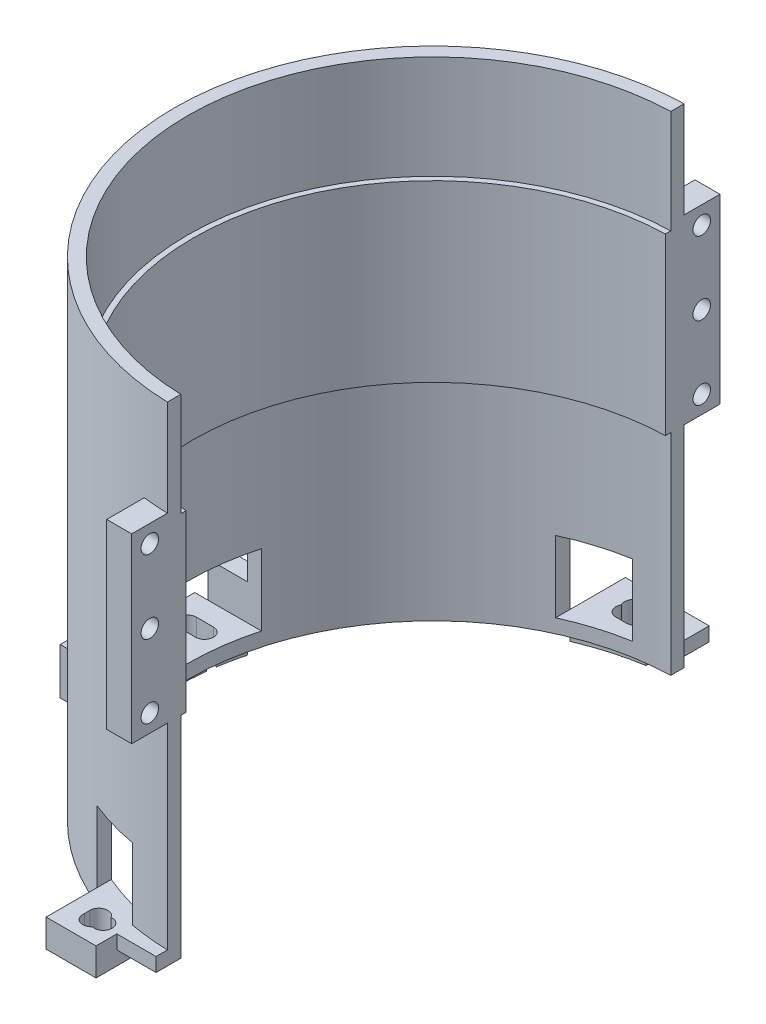
from build123d import *
from build123d.topology import SkipClean

# Parameters (mm, degrees)
BOSS_EXTRUDE1_DEPTH  = 10
BOSS_EXTRUDE2_START  = 73
BOSS_EXTRUDE2_DEPTH  = 73
SKETCH4_R            = 2.5
BOSS_EXTRUDE3_DEPTH  = 3.9
SKETCH6_R            = 2.45
CUT_EXTRUDE1_DEPTH   = 13.9
SKETCH7_W            = 14
SKETCH7_H            = 20
CUT_EXTRUDE2_DEPTH   = 23.9
BOSS_EXTRUDE4_START  = -3.9
BOSS_EXTRUDE4_DEPTH  = 3.9
SKETCH12_W           = 5
SKETCH12_H           = 10
BOSS_EXTRUDE5_DEPTH  = 0.17
SKETCH13_R           = 68.75
CUT_EXTRUDE3_DEPTH   = 73
BOSS_EXTRUDE6_DEPTH  = 27
BOSS_EXTRUDE7_DEPTH  = 27
BOSS_EXTRUDE8_START  = 73
BOSS_EXTRUDE8_DEPTH  = 73
BOSS_EXTRUDE9_START  = -37
BOSS_EXTRUDE9_DEPTH  = 37
BOSS_EXTRUDE10_START = 14
BOSS_EXTRUDE10_DEPTH = 14
CUT_EXTRUDE4_START   = -2
CUT_EXTRUDE4_DEPTH   = 2
SKETCH21_W           = 14
SKETCH21_H           = 20
CUT_EXTRUDE5_DEPTH   = 22
BOSS_EXTRUDE11_START = 14
BOSS_EXTRUDE11_DEPTH = 14
BOSS_EXTRUDE12_START = -5
SKETCH25_R           = 2.45
BOSS_EXTRUDE12_DEPTH = 5
SKETCH24_R           = 2.45
CUT_EXTRUDE6_DEPTH   = 22
BOSS_EXTRUDE13_START = -5
SKETCH26_R           = 2.45
BOSS_EXTRUDE13_DEPTH = 5
BOSS_EXTRUDE14_START = 14
BOSS_EXTRUDE14_DEPTH = 14
SKETCH29_R           = 2.45
CUT_EXTRUDE7_DEPTH   = 22
SKETCH31_R           = 2.5
BOSS_EXTRUDE15_DEPTH = 7.8
SKETCH30_R           = 2.5
CUT_EXTRUDE8_DEPTH   = 30
SKETCH32_W           = 14
SKETCH32_H           = 7.8
BOSS_EXTRUDE16_DEPTH = 1.5
SKETCH33_R           = 2.5
BOSS_EXTRUDE18_DEPTH = 7.8
SKETCH34_R           = 2.5
CUT_EXTRUDE9_DEPTH   = 31.5
SKETCH35_W           = 16.5
SKETCH35_H           = 20
CUT_EXTRUDE10_DEPTH  = 31.5
SKETCH36_W           = 12.20849107
SKETCH36_H           = 3.9
BOSS_EXTRUDE19_DEPTH = 7
SKETCH38_W           = 49.306591442
SKETCH38_H           = 156.02496744
SKETCH38_W_2         = 56.736351796
SKETCH38_H_2         = 161.653573769
CUT_EXTRUDE11_DEPTH  = 2
SKETCH40_W           = 11.909879212
SKETCH40_H           = 51
SKETCH40_R           = 2.45
SKETCH40_W_2         = 13.444666712
BOSS_EXTRUDE20_DEPTH = 4
CUT_EXTRUDE12_DEPTH  = 12
SKETCH42_W           = 36.5
SKETCH42_H           = 20
CUT_EXTRUDE14_DEPTH  = 42
BOSS_EXTRUDE21_START = -3
BOSS_EXTRUDE21_DEPTH = 3
BOSS_EXTRUDE22_DEPTH = 10
CUT_EXTRUDE15_DEPTH  = 23
SKETCH46_R           = 2.5
CUT_EXTRUDE16_DEPTH  = 23
SKETCH47_W           = 36.5
SKETCH47_H           = 7.8
CUT_EXTRUDE17_DEPTH  = 2
CUT_EXTRUDE18_DEPTH  = 1.5
CUT_EXTRUDE19_DEPTH  = 29
CUT_EXTRUDE20_DEPTH  = 59
CUT_EXTRUDE21_DEPTH  = 2


with BuildPart() as part:
    # Sketch1 → Boss-Extrude1 (new body)
    with BuildSketch(Plane(origin=(0, 0, 0), x_dir=(1, 0, 0), z_dir=(0, 1, 0))):
        with BuildLine():
            Line((0, -67.5), (0, -82.327380707))
            Line((0, -82.327380707), (-5, -82.327380707))
            Line((-5, -82.327380707), (-5, -72.327380707))
            ThreePointArc((-5, -72.327380707), (-72.5, 0), (-5, 72.327380707))
            Line((-5, 72.327380707), (-5, 82.5))
            Line((-5, 82.5), (0, 82.5))
            Line((0, 82.5), (0, 67.5))
            ThreePointArc((0, 67.5), (-67.5, 0), (0, -67.5))
        make_face()
    extrude(amount=BOSS_EXTRUDE1_DEPTH)

    # Sketch2 → Boss-Extrude2 (add)
    with BuildSketch(Plane.XZ.offset(BOSS_EXTRUDE2_START)):
        with BuildLine():
            Line((0, 72.5), (0, 68.5))
            ThreePointArc((0, 68.5), (-68.5, 0), (0, -68.5))
            Line((0, -68.5), (0, -72.5))
            ThreePointArc((0, -72.5), (-72.5, 0), (0, 72.5))
        make_face()
    extrude(amount=-BOSS_EXTRUDE2_DEPTH)

    # Sketch4 → Boss-Extrude3 (add, symmetric)
    # profile 1 of 3: a face of its own
    with BuildSketch(Plane.XZ.offset(73)):
        with BuildLine():
            Line((-27, 80), (-27, 67.284842275))
            ThreePointArc((-27, 67.284842275), (-20.101757111, 69.657514749), (-13, 71.324960568))
            Line((-13, 71.324960568), (-13, 80))
            Line((-13, 80), (-27, 80))
        make_face()
        with Locations(Location((-20, 73, 0), (0, 0, 270))):
            Circle(SKETCH4_R, mode=Mode.SUBTRACT)
    # profile 2 of 3: a face of its own
    with BuildSketch(Plane.XZ.offset(73)):
        with BuildLine():
            Line((-87, -18.19657614), (-70.179303336, -18.19657614))
            ThreePointArc((-70.179303336, -18.19657614), (-72.499978985, 0.055201399), (-70.151512279, 18.30342386))
            Line((-70.151512279, 18.30342386), (-87, 18.30342386))
            Line((-87, 18.30342386), (-87, -18.19657614))
        make_face()
        with Locations(Location((-78.75, -9.94657614, 0), (0, 0, 270))):
            Circle(SKETCH4_R, mode=Mode.SUBTRACT)
        with Locations(Location((-78.75, 10.05342386, 0), (0, 0, 270))):
            Circle(SKETCH4_R, mode=Mode.SUBTRACT)
    # profile 3 of 3: a face of its own
    with BuildSketch(Plane.XZ.offset(73)):
        with BuildLine():
            ThreePointArc((-11.75, -71.54150893), (-20.141813113, -69.645942915), (-28.25, -66.769660026))
            Line((-28.25, -66.769660026), (-28.25, -83.75))
            Line((-28.25, -83.75), (-11.75, -83.75))
            Line((-11.75, -83.75), (-11.75, -71.54150893))
        make_face()
        with Locations(Location((-20, -75.5, 0), (0, 0, 270))):
            Circle(SKETCH4_R, mode=Mode.SUBTRACT)
    extrude(amount=BOSS_EXTRUDE3_DEPTH, both=True)

    # Sketch6 → Cut-Extrude1 (cut)
    with BuildSketch(Plane.ZY.offset(5)):
        with Locations((77.412380707, 5)):
            Circle(SKETCH6_R)
        with Locations((-77.413690354, 5)):
            Circle(SKETCH6_R)
    extrude(amount=-CUT_EXTRUDE1_DEPTH, mode=Mode.SUBTRACT)

    # Sketch7 → Cut-Extrude2 (cut)
    with BuildSketch(Plane.XY.offset(80)):
        with Locations((-20, -59.1)):
            Rectangle(SKETCH7_W, SKETCH7_H)
    extrude(amount=-CUT_EXTRUDE2_DEPTH, mode=Mode.SUBTRACT)

    # Sketch10 → Boss-Extrude4 (add)
    with BuildSketch(Plane(origin=(0, -69.1, 0), x_dir=(1, 0, 0), z_dir=(0, 1, 0)).offset(BOSS_EXTRUDE4_START)):
        with BuildLine():
            Line((-13, -71.324960568), (-13, -75.662480284))
            Line((-13, -75.662480284), (0, -75.662480284))
            Line((0, -75.662480284), (0, -72.5))
            ThreePointArc((0, -72.5), (-6.526498251, -72.205642581), (-13, -71.324960568))
        make_face()
    extrude(amount=BOSS_EXTRUDE4_DEPTH)

    # Sketch12 → Boss-Extrude5 (add)
    with BuildSketch(Plane.XY.offset(82.327380707)):
        with Locations((-2.5, 5)):
            Rectangle(SKETCH12_W, SKETCH12_H)
    extrude(amount=BOSS_EXTRUDE5_DEPTH)

    # Sketch13 → Cut-Extrude3 (cut)
    with BuildSketch(Plane.XZ.offset(73)):
        Circle(SKETCH13_R)
    extrude(amount=-CUT_EXTRUDE3_DEPTH, mode=Mode.SUBTRACT)

    # Sketch14 → Boss-Extrude6 (add)
    with BuildSketch(Plane(origin=(0, 10, 0), x_dir=(1, 0, 0), z_dir=(0, 1, 0))):
        with BuildLine():
            Line((-5, -72.327380707), (-5, -82.497380707))
            Line((-5, -82.497380707), (0, -82.497380707))
            Line((0, -82.497380707), (0, -67.5))
            ThreePointArc((0, -67.5), (-67.5, 0), (0, 67.5))
            Line((0, 67.5), (0, 82.5))
            Line((0, 82.5), (-5, 82.5))
            Line((-5, 82.5), (-5, 72.327380707))
            ThreePointArc((-5, 72.327380707), (-72.5, 0), (-5, -72.327380707))
        make_face()
    extrude(amount=BOSS_EXTRUDE6_DEPTH)

    # Sketch15 → Boss-Extrude7 (add)
    with BuildSketch(Plane(origin=(0, 37, 0), x_dir=(1, 0, 0), z_dir=(0, 1, 0))):
        with BuildLine():
            Line((0, 68.2), (0, 72.5))
            ThreePointArc((0, 72.5), (-72.5, 0), (0, -72.5))
            Line((0, -72.5), (0, -68.2))
            ThreePointArc((0, -68.2), (-68.2, 0), (0, 68.2))
        make_face()
    extrude(amount=BOSS_EXTRUDE7_DEPTH)

    # Sketch17 → Boss-Extrude8 (add)
    with BuildSketch(Plane.XZ.offset(BOSS_EXTRUDE8_START)):
        with BuildLine():
            Line((0, 68.2), (0, 68.75))
            ThreePointArc((0, 68.75), (-68.75, 0), (0, -68.75))
            Line((0, -68.75), (0, -68.2))
            ThreePointArc((0, -68.2), (-68.2, 0), (0, 68.2))
        make_face()
    extrude(amount=-BOSS_EXTRUDE8_DEPTH)

    # Sketch18 → Boss-Extrude9 (add)
    with BuildSketch(Plane(origin=(0, 37, 0), x_dir=(1, 0, 0), z_dir=(0, 1, 0)).offset(BOSS_EXTRUDE9_START)):
        with BuildLine():
            Line((0, -67.25), (0, -67.5))
            ThreePointArc((0, -67.5), (-67.5, 0), (0, 67.5))
            Line((0, 67.5), (0, 67.25))
            ThreePointArc((0, 67.25), (-67.25, 0), (0, -67.25))
        make_face()
    extrude(amount=BOSS_EXTRUDE9_DEPTH)

    # Sketch19 → Boss-Extrude10 (add)
    with BuildSketch(Plane.XZ.offset(BOSS_EXTRUDE10_START)):
        with BuildLine():
            Line((0, -68.2), (0, -67.25))
            ThreePointArc((0, -67.25), (-67.25, 0), (0, 67.25))
            Line((0, 67.25), (0, 68.2))
            ThreePointArc((0, 68.2), (-68.2, 0), (0, -68.2))
        make_face()
    extrude(amount=-BOSS_EXTRUDE10_DEPTH)

    # Sketch20 → Cut-Extrude4 (cut)
    with BuildSketch(Plane(origin=(0, 37, 0), x_dir=(1, 0, 0), z_dir=(0, 1, 0)).offset(CUT_EXTRUDE4_START)):
        with BuildLine():
            Line((0, 67.25), (0, 68.2))
            ThreePointArc((0, 68.2), (-68.2, 0), (0, -68.2))
            Line((0, -68.2), (0, -67.25))
            ThreePointArc((0, -67.25), (-67.25, 0), (0, 67.25))
        make_face()
    extrude(amount=CUT_EXTRUDE4_DEPTH, mode=Mode.SUBTRACT)

    # Sketch21 → Cut-Extrude5 (cut)
    with BuildSketch(Plane.XY.offset(80)):
        with Locations((-20, -59.1)):
            Rectangle(SKETCH21_W, SKETCH21_H)
    extrude(amount=-CUT_EXTRUDE5_DEPTH, mode=Mode.SUBTRACT)

    # Sketch23 → Boss-Extrude11 (add)
    with BuildSketch(Plane.XZ.offset(BOSS_EXTRUDE11_START)):
        with BuildLine():
            Line((0, 72.5), (0, 82.497380707))
            Line((0, 82.497380707), (-5, 82.497380707))
            Line((-5, 82.497380707), (-5, 72.327380707))
            ThreePointArc((-5, 72.327380707), (-2.501489427, 72.456832325), (0, 72.5))
        make_face()
    extrude(amount=-BOSS_EXTRUDE11_DEPTH)

    # Sketch25 → Boss-Extrude12 (add)
    with BuildSketch(Plane(origin=(0, 0, 0), x_dir=(0, 0, -1), z_dir=(1, 0, 0)).offset(BOSS_EXTRUDE12_START)):
        with Locations((-77.412380707, 5)):
            Circle(SKETCH25_R)
    extrude(amount=BOSS_EXTRUDE12_DEPTH)

    # Sketch24 → Cut-Extrude6 (cut)
    with BuildSketch(Plane(origin=(0, 0, 0), x_dir=(0, 0, -1), z_dir=(1, 0, 0))):
        with Locations((-77.412380707, -9.05)):
            Circle(SKETCH24_R)
        with Locations((-77.412380707, 32.05)):
            Circle(SKETCH24_R)
        with Locations((-77.412380707, 11.5)):
            Circle(SKETCH24_R)
    extrude(amount=-CUT_EXTRUDE6_DEPTH, mode=Mode.SUBTRACT)

    # Sketch26 → Boss-Extrude13 (add)
    with BuildSketch(Plane(origin=(0, 0, 0), x_dir=(0, 0, -1), z_dir=(1, 0, 0)).offset(BOSS_EXTRUDE13_START)):
        with Locations((77.413690354, 5)):
            Circle(SKETCH26_R)
    extrude(amount=BOSS_EXTRUDE13_DEPTH)

    # Sketch27 → Boss-Extrude14 (add)
    with BuildSketch(Plane.XZ.offset(BOSS_EXTRUDE14_START)):
        with BuildLine():
            Line((-5, -72.327380707), (-5, -82.5))
            Line((-5, -82.5), (0, -82.5))
            Line((0, -82.5), (0, -72.5))
            ThreePointArc((0, -72.5), (-2.501489427, -72.456832325), (-5, -72.327380707))
        make_face()
    extrude(amount=-BOSS_EXTRUDE14_DEPTH)

    # Sketch29 → Cut-Extrude7 (cut)
    with BuildSketch(Plane(origin=(0, 0, 0), x_dir=(0, 0, -1), z_dir=(1, 0, 0))):
        with Locations((77.41, 32.05)):
            Circle(SKETCH29_R)
        with Locations((77.41, 11.5)):
            Circle(SKETCH29_R)
        with Locations((77.41, -9.05)):
            Circle(SKETCH29_R)
    extrude(amount=-CUT_EXTRUDE7_DEPTH, mode=Mode.SUBTRACT)

    # Sketch31 → Boss-Extrude15 (add)
    with BuildSketch(Plane(origin=(0, -69.1, 0), x_dir=(1, 0, 0), z_dir=(0, 1, 0))):
        with Locations((-20, -73)):
            Circle(SKETCH31_R)
    extrude(amount=-BOSS_EXTRUDE15_DEPTH)

    # Sketch30 → Cut-Extrude8 (cut)
    with BuildSketch(Plane(origin=(0, -69.1, 0), x_dir=(1, 0, 0), z_dir=(0, 1, 0))):
        with Locations(Location((-20, -75.71, 0), (0, 0, 270))):
            Circle(SKETCH30_R)
    extrude(amount=-CUT_EXTRUDE8_DEPTH, mode=Mode.SUBTRACT)

    # Sketch32 → Boss-Extrude16 (add)
    with BuildSketch(Plane.XY.offset(80)):
        with Locations((-20, -73)):
            Rectangle(SKETCH32_W, SKETCH32_H)
    extrude(amount=BOSS_EXTRUDE16_DEPTH)

    # Sketch33 → Boss-Extrude18 (add)
    with BuildSketch(Plane(origin=(0, -69.1, 0), x_dir=(1, 0, 0), z_dir=(0, 1, 0))):
        with Locations((-20, 75.5)):
            Circle(SKETCH33_R)
    extrude(amount=-BOSS_EXTRUDE18_DEPTH)

    # Sketch34 → Cut-Extrude9 (cut)
    with BuildSketch(Plane(origin=(0, -69.1, 0), x_dir=(1, 0, 0), z_dir=(0, 1, 0))):
        with Locations(Location((-20, 73.79, 0), (0, 0, 270))):
            Circle(SKETCH34_R)
    extrude(amount=-CUT_EXTRUDE9_DEPTH, mode=Mode.SUBTRACT)

    # Sketch35 → Cut-Extrude10 (cut)
    with BuildSketch(Plane(origin=(0, 0, -83.75), x_dir=(-1, 0, 0), z_dir=(0, 0, -1))):
        with Locations((20, -59.1)):
            Rectangle(SKETCH35_W, SKETCH35_H)
    extrude(amount=-CUT_EXTRUDE10_DEPTH, mode=Mode.SUBTRACT)

    # Sketch36 → Boss-Extrude19 (add)
    with BuildSketch(Plane(origin=(-11.75, 0, 0), x_dir=(0, 0, -1), z_dir=(1, 0, 0))):
        with Locations((77.645754465, -71.05)):
            Rectangle(SKETCH36_W, SKETCH36_H)
    extrude(amount=BOSS_EXTRUDE19_DEPTH)

    # Sketch38 → Cut-Extrude11 (cut)
    with BuildSketch(Plane(origin=(0, 0, 0), x_dir=(0, 0, -1), z_dir=(1, 0, 0))):
        with Locations((-83.987722436, -2.149293648)):
            Rectangle(SKETCH38_W, SKETCH38_H)
        with Locations((75.076692421, -0.685856002)):
            Rectangle(SKETCH38_W_2, SKETCH38_H_2)
    extrude(amount=-CUT_EXTRUDE11_DEPTH, mode=Mode.SUBTRACT)

    # Sketch40 → Boss-Extrude20 (add)
    # profile 1 of 2: a face of its own
    with SkipClean():  # the faces are left unmerged after this step: merging them gives an invalid solid
        with BuildSketch(Plane.ZY.offset(5)):
            with Locations((76.542441101, 11.5)):
                Rectangle(SKETCH40_W, SKETCH40_H)
            with Locations(Location((77.412380707, -9.05, 0), (0, 0, 180))):
                Circle(SKETCH40_R, mode=Mode.SUBTRACT)
            with Locations(Location((77.412380707, 11.5, 0), (0, 0, 180))):
                Circle(SKETCH40_R, mode=Mode.SUBTRACT)
            with Locations(Location((77.412380707, 32.05, 0), (0, 0, 180))):
                Circle(SKETCH40_R, mode=Mode.SUBTRACT)
        # profile 2 of 2: a face of its own
        with BuildSketch(Plane.ZY.offset(5)):
            with Locations((-75.777666644, 11.5)):
                Rectangle(SKETCH40_W_2, SKETCH40_H)
            with Locations((-77.41, -9.05)):
                Circle(SKETCH40_R, mode=Mode.SUBTRACT)
            with Locations((-77.41, 11.5)):
                Circle(SKETCH40_R, mode=Mode.SUBTRACT)
            with Locations((-77.41, 32.05)):
                Circle(SKETCH40_R, mode=Mode.SUBTRACT)
        extrude(amount=BOSS_EXTRUDE20_DEPTH)

    # Sketch41 → Cut-Extrude12 (cut)
    with SkipClean():  # the faces are left unmerged after this step: merging them gives an invalid solid
        with BuildSketch(Plane(origin=(0, -69.1, 0), x_dir=(1, 0, 0), z_dir=(0, 1, 0))):
            with BuildLine():
                ThreePointArc((-71.670843535, -10.93344351), (-71.840240735, -9.758576283), (-71.990380195, -8.581093138))
                ThreePointArc((-71.990380195, -8.581093138), (-72.877440098, -7.825103101), (-74.010836145, -7.55342386))
                Line((-74.010836145, -7.55342386), (-78.75, -7.55342386))
                ThreePointArc((-78.75, -7.55342386), (-76.982233047, -8.285656907), (-76.25, -10.05342386))
                ThreePointArc((-76.25, -10.05342386), (-76.982233047, -11.821190813), (-78.75, -12.55342386))
                Line((-78.75, -12.55342386), (-74.010836145, -12.55342386))
                ThreePointArc((-74.010836145, -12.55342386), (-72.587819828, -12.108910314), (-71.670843535, -10.93344351))
            make_face()
            with BuildLine():
                ThreePointArc((-76.25, -10.05342386), (-76.982233047, -8.285656907), (-78.75, -7.55342386))
                Line((-78.75, -7.55342386), (-78.75, -12.55342386))
                ThreePointArc((-78.75, -12.55342386), (-76.982233047, -11.821190813), (-76.25, -10.05342386))
            make_face()
            with BuildLine():
                Line((-78.75, -12.55342386), (-78.75, -7.55342386))
                ThreePointArc((-78.75, -7.55342386), (-81.25, -10.05342386), (-78.75, -12.55342386))
            make_face()
            with BuildLine():
                Line((-74.010836145, 7.44657614), (-78.75, 7.44657614))
                Line((-78.75, 7.44657614), (-78.75, 12.44657614))
                Line((-78.75, 12.44657614), (-74.010836145, 12.44657614))
                ThreePointArc((-74.010836145, 12.44657614), (-71.510836145, 9.94657614), (-74.010836145, 7.44657614))
            make_face()
        extrude(amount=-CUT_EXTRUDE12_DEPTH, mode=Mode.SUBTRACT)

    # Sketch42 → Cut-Extrude14 (cut)
    with SkipClean():  # the faces are left unmerged after this step: merging them gives an invalid solid
        with BuildSketch(Plane.ZY.offset(87)):
            with Locations((0.05342386, -59.1)):
                Rectangle(SKETCH42_W, SKETCH42_H)
        extrude(amount=-CUT_EXTRUDE14_DEPTH, mode=Mode.SUBTRACT)

    # Sketch43 → Boss-Extrude21 (add)
    with SkipClean():  # the faces are left unmerged after this step: merging them gives an invalid solid
        with BuildSketch(Plane(origin=(0, -69.1, 0), x_dir=(1, 0, 0), z_dir=(0, 1, 0)).offset(BOSS_EXTRUDE21_START)):
            with BuildLine():
                Line((-81.25, -18.30342386), (-81.25, -23.30342386))
                Line((-81.25, -23.30342386), (-68.652752577, -23.30342386))
                ThreePointArc((-68.652752577, -23.30342386), (-69.447145266, -20.816916545), (-70.151512279, -18.30342386))
                Line((-70.151512279, -18.30342386), (-81.25, -18.30342386))
            make_face()
            with BuildLine():
                Line((-81.25, 18.19657614), (-81.25, 23.19657614))
                Line((-81.25, 23.19657614), (-68.688928186, 23.19657614))
                ThreePointArc((-68.688928186, 23.19657614), (-69.479107878, 20.709987167), (-70.179303336, 18.19657614))
                Line((-70.179303336, 18.19657614), (-81.25, 18.19657614))
            make_face()
        extrude(amount=BOSS_EXTRUDE21_DEPTH)

    # Sketch44 → Boss-Extrude22 (add)
    with SkipClean():  # the faces are left unmerged after this step: merging them gives an invalid solid
        with BuildSketch(Plane(origin=(0, -69.1, 0), x_dir=(1, 0, 0), z_dir=(0, 1, 0))):
            with BuildLine():
                Line((-81.25, 23.19657614), (-81.25, 18.19657614))
                Line((-81.25, 18.19657614), (-70.179303336, 18.19657614))
                ThreePointArc((-70.179303336, 18.19657614), (-69.479107878, 20.709987167), (-68.688928186, 23.19657614))
                Line((-68.688928186, 23.19657614), (-81.25, 23.19657614))
            make_face()
            with BuildLine():
                Line((-81.25, -18.30342386), (-81.25, -23.30342386))
                Line((-81.25, -23.30342386), (-68.652752577, -23.30342386))
                ThreePointArc((-68.652752577, -23.30342386), (-69.447145266, -20.816916545), (-70.151512279, -18.30342386))
                Line((-70.151512279, -18.30342386), (-81.25, -18.30342386))
            make_face()
        extrude(amount=BOSS_EXTRUDE22_DEPTH)

    # Sketch45 → Cut-Extrude15 (cut)
    with SkipClean():  # the faces are left unmerged after this step: merging them gives an invalid solid
        with BuildSketch(Plane(origin=(0, -69.1, 0), x_dir=(1, 0, 0), z_dir=(0, 1, 0))):
            with BuildLine():
                ThreePointArc((-19.383212835, -73.287279712), (-21.370637214, -73.619221765), (-22.467686626, -75.309347137))
                Line((-22.467686626, -75.309347137), (-22.449489743, -76.21))
                Line((-22.449489743, -76.21), (-19.690318638, -76.21))
                ThreePointArc((-19.690318638, -76.21), (-20.011567337, -74.698749921), (-19.383212835, -73.287279712))
            make_face()
            with BuildLine():
                ThreePointArc((-17.532313374, -75.309347137), (-18.155905694, -74.022008237), (-19.383212835, -73.287279712))
                ThreePointArc((-19.383212835, -73.287279712), (-20.011567337, -74.698749921), (-19.690318638, -76.21))
                Line((-19.690318638, -76.21), (-17.550510257, -76.21))
                Line((-17.550510257, -76.21), (-17.532313374, -75.309347137))
            make_face()
            with BuildLine():
                ThreePointArc((-17.824648029, -72.477991964), (-20.637032209, -71.292524051), (-22.5, -73.71))
                Line((-22.5, -73.71), (-22.497959804, -73.810979294))
                Line((-22.497959804, -73.810979294), (-22.467686626, -75.309347137))
                ThreePointArc((-22.467686626, -75.309347137), (-21.370637214, -73.619221765), (-19.383212835, -73.287279712))
                ThreePointArc((-19.383212835, -73.287279712), (-18.677330245, -72.741278989), (-17.824648029, -72.477991964))
            make_face()
            with BuildLine():
                ThreePointArc((-15.025255129, -74.96), (-15.86671394, -73.089374135), (-17.824648029, -72.477991964))
                ThreePointArc((-17.824648029, -72.477991964), (-17.582524051, -73.072967791), (-17.5, -73.71))
                ThreePointArc((-17.5, -73.71), (-17.500510101, -73.760499951), (-17.502040196, -73.810979294))
                Line((-17.502040196, -73.810979294), (-17.532313374, -75.309347137))
                ThreePointArc((-17.532313374, -75.309347137), (-17.508091438, -75.509023092), (-17.5, -75.71))
                ThreePointArc((-17.5, -75.71), (-17.512659617, -75.961272405), (-17.550510257, -76.21))
                ThreePointArc((-17.550510257, -76.21), (-17.767883493, -76.83590226), (-18.142042294, -77.382720288))
                ThreePointArc((-18.142042294, -77.382720288), (-15.990974827, -76.933824703), (-15.025255129, -74.96))
            make_face()
            with BuildLine():
                ThreePointArc((-17.5, -73.71), (-17.582524051, -73.072967791), (-17.824648029, -72.477991964))
                ThreePointArc((-17.824648029, -72.477991964), (-18.677330245, -72.741278989), (-19.383212835, -73.287279712))
                ThreePointArc((-19.383212835, -73.287279712), (-18.155905694, -74.022008237), (-17.532313374, -75.309347137))
                Line((-17.532313374, -75.309347137), (-17.502040196, -73.810979294))
                Line((-17.502040196, -73.810979294), (-17.5, -73.71))
            make_face()
            with BuildLine():
                Line((-19.690318638, -76.21), (-22.449489743, -76.21))
                ThreePointArc((-22.449489743, -76.21), (-20.656731114, -78.122199047), (-18.142042294, -77.382720288))
                ThreePointArc((-18.142042294, -77.382720288), (-19.034722423, -76.952864393), (-19.690318638, -76.21))
            make_face()
            with BuildLine():
                ThreePointArc((-19.690318638, -76.21), (-19.034722423, -76.952864393), (-18.142042294, -77.382720288))
                ThreePointArc((-18.142042294, -77.382720288), (-17.767883493, -76.83590226), (-17.550510257, -76.21))
                Line((-17.550510257, -76.21), (-19.690318638, -76.21))
            make_face()
        extrude(amount=-CUT_EXTRUDE15_DEPTH, mode=Mode.SUBTRACT)


with BuildPart() as cut_extrude15_kept_piece:
    # of the separate pieces the step leaves, the one the design keeps (cut_extrude15_pieces_kept)
    add(part.part.solids().sort_by_distance((-2, 37, -82.5))[0])

    # Sketch46 → Cut-Extrude16 (cut)
    with SkipClean():  # the faces are left unmerged after this step: merging them gives an invalid solid
        with BuildSketch(Plane(origin=(0, -69.1, 0), x_dir=(1, 0, 0), z_dir=(0, 1, 0))):
            with Locations((-20, 76.29)):
                Circle(SKETCH46_R)
            with BuildLine():
                Line((-20, 76.29), (-17, 76.29))
                ThreePointArc((-17, 76.29), (-14.5, 73.79), (-17, 71.29))
                Line((-17, 71.29), (-20, 71.29))
                Line((-20, 71.29), (-20, 76.29))
            make_face()
        extrude(amount=-CUT_EXTRUDE16_DEPTH, mode=Mode.SUBTRACT)

    # Sketch47 → Cut-Extrude17 (cut)
    with SkipClean():  # the faces are left unmerged after this step: merging them gives an invalid solid
        with BuildSketch(Plane.ZY.offset(87)):
            with Locations((0.05342386, -73)):
                Rectangle(SKETCH47_W, SKETCH47_H)
        extrude(amount=-CUT_EXTRUDE17_DEPTH, mode=Mode.SUBTRACT)

    # Sketch48 → Cut-Extrude18 (cut)
    with SkipClean():  # the faces are left unmerged after this step: merging them gives an invalid solid
        with BuildSketch(Plane(origin=(0, 0, -83.75), x_dir=(-1, 0, 0), z_dir=(0, 0, -1))):
            Polygon((28.25, -69.1), (4.75, -69.1), (4.75, -73), (11.75, -73), (11.75, -76.9), (28.25, -76.9), align=None)
        extrude(amount=-CUT_EXTRUDE18_DEPTH, mode=Mode.SUBTRACT)

    # Sketch49 → Cut-Extrude19 (cut)
    with SkipClean():  # the faces are left unmerged after this step: merging them gives an invalid solid
        with BuildSketch(Plane(origin=(0, 64, 0), x_dir=(1, 0, 0), z_dir=(0, 1, 0))):
            with BuildLine():
                Line((-2, 68.170668179), (-2, 68.720902934))
                ThreePointArc((-2, 68.720902934), (-68.75, 0), (-2, -68.720902934))
                Line((-2, -68.720902934), (-2, -68.170668179))
                ThreePointArc((-2, -68.170668179), (-68.2, 0), (-2, 68.170668179))
            make_face()
        extrude(amount=-CUT_EXTRUDE19_DEPTH, mode=Mode.SUBTRACT)

    # Sketch50 → Cut-Extrude20 (cut)
    with SkipClean():  # the faces are left unmerged after this step: merging them gives an invalid solid
        with BuildSketch(Plane.XZ.offset(73)):
            with BuildLine():
                Line((-2, 68.170668179), (-2, 68.720902934))
                ThreePointArc((-2, 68.720902934), (-68.75, 0), (-2, -68.720902934))
                Line((-2, -68.720902934), (-2, -68.170668179))
                ThreePointArc((-2, -68.170668179), (-68.2, 0), (-2, 68.170668179))
            make_face()
        extrude(amount=-CUT_EXTRUDE20_DEPTH, mode=Mode.SUBTRACT)

    # Sketch51 → Cut-Extrude21 (cut)
    with SkipClean():  # the faces are left unmerged after this step: merging them gives an invalid solid
        with BuildSketch(Plane.ZY.offset(9)):
            Polygon((81.662380707, 29.596261356), (81.662380707, 34.503738644), (77.412380707, 36.957477288), (73.162380707, 34.503738644), (73.162380707, 29.596261356), (77.412380707, 27.142522712), align=None)
            Polygon((77.412380707, 16.407477288), (73.162380707, 13.953738644), (73.162380707, 9.046261356), (77.412380707, 6.592522712), (81.662380707, 9.046261356), (81.662380707, 13.953738644), align=None)
            Polygon((77.412380707, -4.142522712), (73.162380707, -6.596261356), (73.162380707, -11.503738644), (77.412380707, -13.957477288), (81.662380707, -11.503738644), (81.662380707, -6.596261356), align=None)
            Polygon((-77.41, 36.957477288), (-81.66, 34.503738644), (-81.66, 29.596261356), (-77.41, 27.142522712), (-73.16, 29.596261356), (-73.16, 34.503738644), align=None)
            Polygon((-77.41, 16.407477288), (-81.66, 13.953738644), (-81.66, 9.046261356), (-77.41, 6.592522712), (-73.16, 9.046261356), (-73.16, 13.953738644), align=None)
            Polygon((-77.41, -4.142522712), (-81.66, -6.596261356), (-81.66, -11.503738644), (-77.41, -13.957477288), (-73.16, -11.503738644), (-73.16, -6.596261356), align=None)
        extrude(amount=-CUT_EXTRUDE21_DEPTH, mode=Mode.SUBTRACT)


solid = cut_extrude15_kept_piece.part
